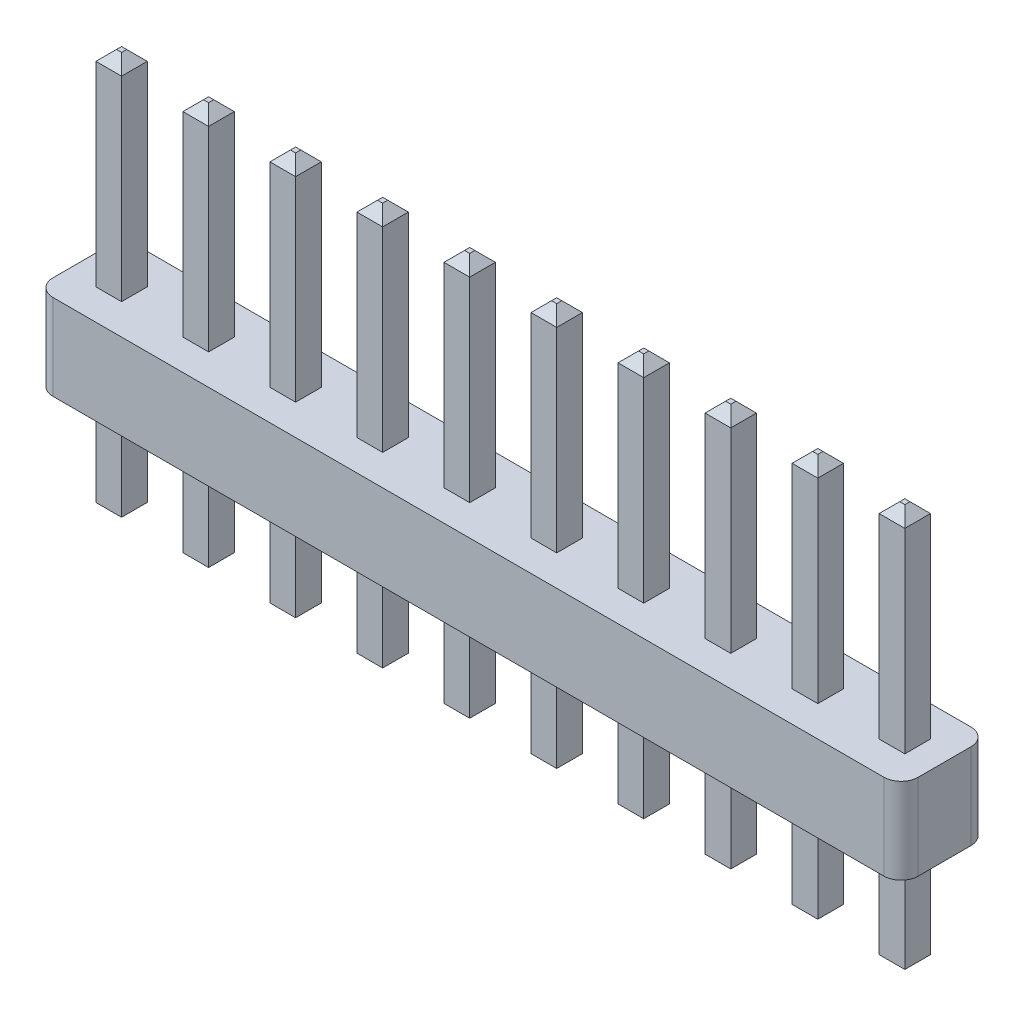
from build123d import *

# Parameters (mm, degrees)
BOSS_EXTRUDE1_DEPTH      = 2.5
BOSS_EXTRUDE2_DEPTH      = 8.5
BOSS_EXTRUDE2_DEPTH_BACK = 3.25
SKETCH2_W                = 0.75
SKETCH2_H                = 0.75
CHAMFER1_SIZE            = 0.3


with BuildPart() as part:
    # Sketch1 → Boss-Extrude1 (new body)
    with BuildSketch(Plane(origin=(0, 0, 0), x_dir=(-1, 0, 0), z_dir=(0, 1, 0))):
        with BuildLine():
            Line((-22.25, 1.27), (2, 1.27))
            ThreePointArc((2, 1.27), (2.353553391, 1.123553391), (2.5, 0.77))
            Line((2.5, 0.77), (2.5, -0.77))
            ThreePointArc((2.5, -0.77), (2.353553391, -1.123553391), (2, -1.27))
            Line((2, -1.27), (-22.25, -1.27))
            ThreePointArc((-22.25, -1.27), (-22.603553391, -1.123553391), (-22.75, -0.77))
            Line((-22.75, -0.77), (-22.75, 0.77))
            ThreePointArc((-22.75, 0.77), (-22.603553391, 1.123553391), (-22.25, 1.27))
        make_face()
    extrude(amount=BOSS_EXTRUDE1_DEPTH)

    # Sketch2 → Boss-Extrude2 (add, two sides: drawn at the far end of the back side and taken through both)
    with BuildSketch(Plane(origin=(0, 0, 0), x_dir=(-1, 0, 0), z_dir=(0, 1, 0)).offset(-BOSS_EXTRUDE2_DEPTH_BACK)):
        with Locations((1.27, 0)):
            Rectangle(SKETCH2_W, SKETCH2_H)
        with Locations((-1.27, 0)):
            Rectangle(SKETCH2_W, SKETCH2_H)
        with Locations((-3.81, 0)):
            Rectangle(SKETCH2_W, SKETCH2_H)
        with Locations((-6.35, 0)):
            Rectangle(SKETCH2_W, SKETCH2_H)
        with Locations((-8.89, 0)):
            Rectangle(SKETCH2_W, SKETCH2_H)
        with Locations((-11.43, 0)):
            Rectangle(SKETCH2_W, SKETCH2_H)
        with Locations((-13.97, 0)):
            Rectangle(SKETCH2_W, SKETCH2_H)
        with Locations((-16.51, 0)):
            Rectangle(SKETCH2_W, SKETCH2_H)
        with Locations((-19.05, 0)):
            Rectangle(SKETCH2_W, SKETCH2_H)
        with Locations((-21.59, 0)):
            Rectangle(SKETCH2_W, SKETCH2_H)
    extrude(amount=BOSS_EXTRUDE2_DEPTH + BOSS_EXTRUDE2_DEPTH_BACK)

    # Chamfer1
    chamfer1_edges = [part.edges().sort_by_distance(p)[0] for p in [
        (9.265, -3.25, 0),
        (8.89, -3.25, 0.375),
        (8.515, -3.25, 0),
        (8.89, -3.25, -0.375),
        (9.265, 8.5, 0),
        (8.89, 8.5, -0.375),
        (8.515, 8.5, 0),
        (8.89, 8.5, 0.375),
        (11.055, -3.25, 0),
        (11.43, -3.25, -0.375),
        (11.805, -3.25, 0),
        (11.43, -3.25, 0.375),
        (11.055, 8.5, 0),
        (11.43, 8.5, 0.375),
        (11.805, 8.5, 0),
        (11.43, 8.5, -0.375),
        (14.345, -3.25, 0),
        (13.97, -3.25, 0.375),
        (13.595, -3.25, 0),
        (13.97, -3.25, -0.375),
        (14.345, 8.5, 0),
        (13.97, 8.5, -0.375),
        (13.595, 8.5, 0),
        (13.97, 8.5, 0.375),
        (16.135, -3.25, 0),
        (16.51, -3.25, -0.375),
        (16.885, -3.25, 0),
        (16.51, -3.25, 0.375),
        (16.135, 8.5, 0),
        (16.51, 8.5, 0.375),
        (16.885, 8.5, 0),
        (16.51, 8.5, -0.375),
        (19.425, -3.25, 0),
        (19.05, -3.25, 0.375),
        (18.675, -3.25, 0),
        (19.05, -3.25, -0.375),
        (19.425, 8.5, 0),
        (19.05, 8.5, -0.375),
        (18.675, 8.5, 0),
        (19.05, 8.5, 0.375),
        (21.215, -3.25, 0),
        (21.59, -3.25, -0.375),
        (21.965, -3.25, 0),
        (21.59, -3.25, 0.375),
        (21.215, 8.5, 0),
        (21.59, 8.5, 0.375),
        (21.965, 8.5, 0),
        (21.59, 8.5, -0.375),
        (-0.895, -3.25, 0),
        (-1.27, -3.25, 0.375),
        (-1.645, -3.25, 0),
        (-1.27, -3.25, -0.375),
        (-0.895, 8.5, 0),
        (-1.27, 8.5, -0.375),
        (-1.645, 8.5, 0),
        (-1.27, 8.5, 0.375),
        (0.895, -3.25, 0),
        (1.27, -3.25, -0.375),
        (1.645, -3.25, 0),
        (1.27, -3.25, 0.375),
        (0.895, 8.5, 0),
        (1.27, 8.5, 0.375),
        (1.645, 8.5, 0),
        (1.27, 8.5, -0.375),
        (4.185, -3.25, 0),
        (3.81, -3.25, 0.375),
        (3.435, -3.25, 0),
        (3.81, -3.25, -0.375),
        (4.185, 8.5, 0),
        (3.81, 8.5, -0.375),
        (3.435, 8.5, 0),
        (3.81, 8.5, 0.375),
        (5.975, -3.25, 0),
        (6.35, -3.25, -0.375),
        (6.725, -3.25, 0),
        (6.35, -3.25, 0.375),
        (5.975, 8.5, 0),
        (6.35, 8.5, 0.375),
        (6.725, 8.5, 0),
        (6.35, 8.5, -0.375),
    ]]
    chamfer(chamfer1_edges, length=CHAMFER1_SIZE)


solid = part.part
